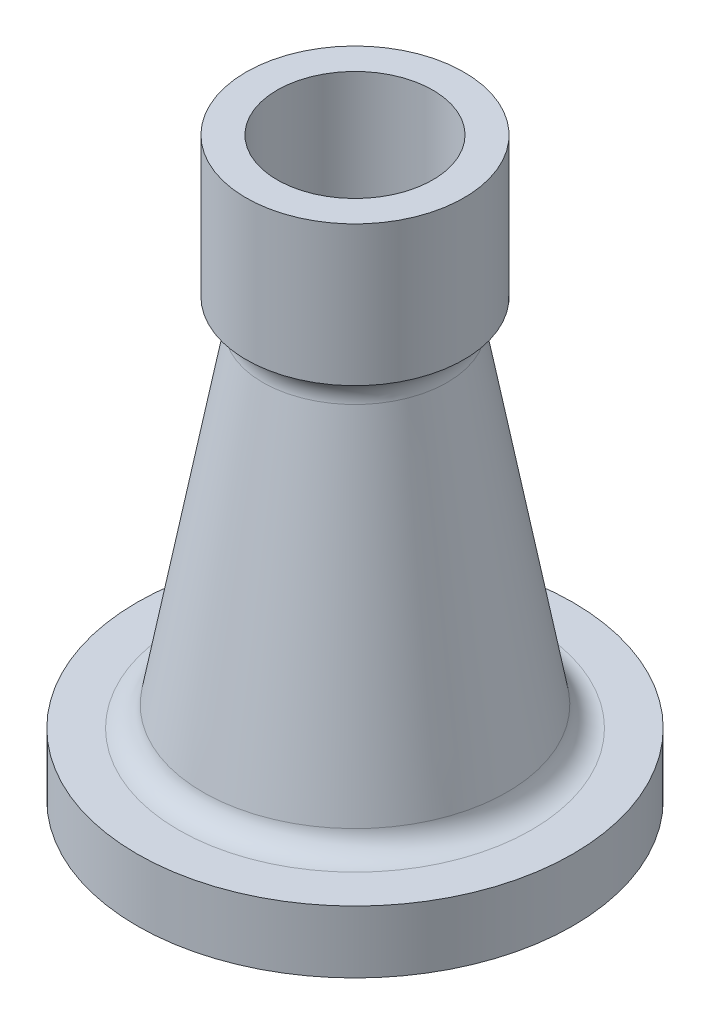
from build123d import *


with BuildPart() as part:
    # Sketch3 → Revolve1 (revolve)
    with BuildSketch(Plane.XY, mode=Mode.PRIVATE) as revolve1_sk:
        with BuildLine():
            Line((25, 92.5), (25, 8.21170714))
            Line((25, 8.21170714), (42.956663453, -89.5))
            Line((42.956663453, -89.5), (47.5, -89.5))
            ThreePointArc((47.5, -89.5), (49.267766953, -90.232233047), (50, -92))
            Line((50, -92), (50, -92.5))
            Line((50, -92.5), (70, -92.5))
            Line((70, -92.5), (70, -72.5))
            Line((70, -72.5), (56.663791728, -72.5))
            ThreePointArc((56.663791728, -72.5), (51.543620306, -70.646856482), (48.795552004, -65.945961153))
            Line((48.795552004, -65.945961153), (29.610902689, 38.447866821))
            ThreePointArc((29.610902689, 38.447866821), (30.60510735, 43.986216269), (35, 47.5))
            Line((35, 47.5), (35, 92.5))
            Line((35, 92.5), (25, 92.5))
        make_face()
    revolve(revolve1_sk.sketch.rotate(Axis((0, 92.5, 0), (0, -1, 0)), 180), axis=Axis((0, 92.5, 0), (0, -1, 0)))


solid = part.part
